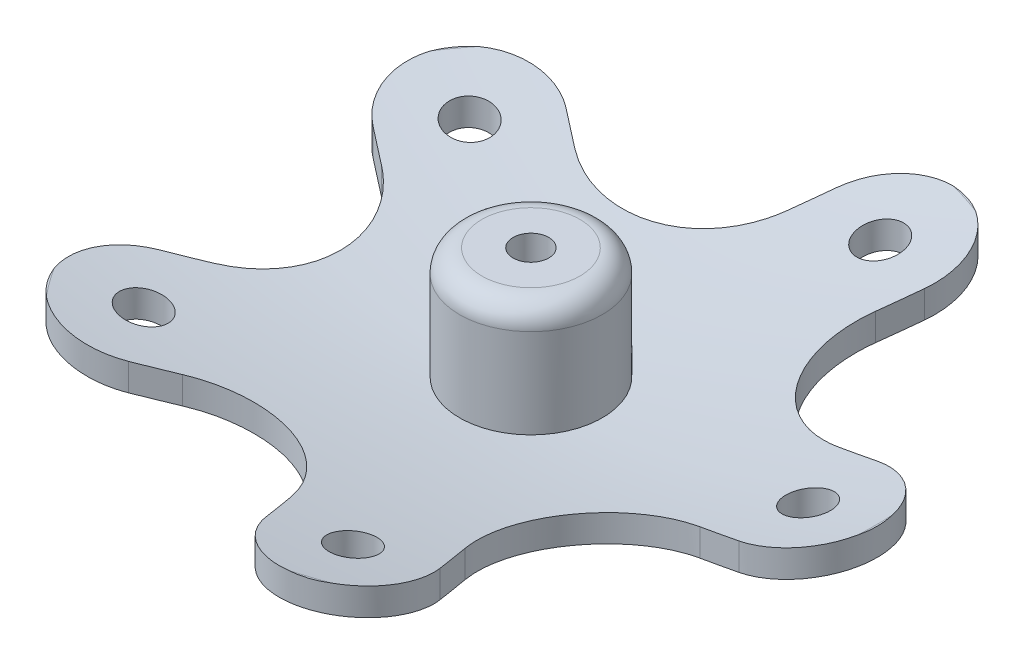
from build123d import *

# Parameters (mm, degrees)
SKETCH1_R                = 4.8
BOSS_EXTRUDE1_DEPTH      = 7.8
SKETCH2_R                = 1.2
CUT_EXTRUDE1_DEPTH       = 7.8
FILLET1_R                = 1.5
BOSS_EXTRUDE2_DEPTH      = 1.8
BOSS_EXTRUDE2_DEPTH_BACK = 4
SKETCH3_R                = 1.5
SKETCH5_R                = 0.75
CUT_EXTRUDE2_DEPTH       = 29.4


with BuildPart() as part:
    # Sketch1 → Boss-Extrude1 (new body)
    with BuildSketch(Plane(origin=(0, 0, 0), x_dir=(1, 0, 0), z_dir=(0, 1, 0))):
        with Locations(Location((0, 0, 0), (0, 0, 270))):
            Circle(SKETCH1_R)
    extrude(amount=BOSS_EXTRUDE1_DEPTH)

    # Sketch2 → Cut-Extrude1 (cut)
    with BuildSketch(Plane(origin=(0, 7.8, 0), x_dir=(1, 0, 0), z_dir=(0, 1, 0))):
        with Locations(Location((0, 0, 0), (0, 0, 270))):
            Circle(SKETCH2_R)
    extrude(amount=-CUT_EXTRUDE1_DEPTH, mode=Mode.SUBTRACT)

    # Fillet1
    fillet1_edges = [part.edges().sort_by_distance(p)[0] for p in [
        (0, 7.8, -4.8),
    ]]
    fillet(fillet1_edges, radius=FILLET1_R)

    # Sketch3 → Boss-Extrude2 (add, two sides: drawn at the far end of the back side and taken through both)
    with BuildSketch(Plane.XZ.offset(-BOSS_EXTRUDE2_DEPTH_BACK)):
        with BuildLine():
            Line((18.645, 4.65), (16.034849373, 4.65))
            ThreePointArc((16.034849373, 4.65), (10.371730413, 7.535503234), (9.377453759, 13.813118961))
            Line((9.377453759, 13.813118961), (10.184034661, 16.295519722))
            ThreePointArc((10.184034661, 16.295519722), (7.198550884, 22.154861547), (1.339209059, 19.16937777))
            Line((1.339209059, 19.16937777), (0.532628158, 16.686977008))
            ThreePointArc((0.532628158, 16.686977008), (-3.961648496, 12.192700355), (-10.239264222, 13.186977008))
            Line((-10.239264222, 13.186977008), (-12.350920437, 14.721185053))
            ThreePointArc((-12.350920437, 14.721185053), (-18.846050884, 13.692457452), (-17.817323283, 7.197327005))
            Line((-17.817323283, 7.197327005), (-15.705667069, 5.663118961))
            ThreePointArc((-15.705667069, 5.663118961), (-12.820163835, 0), (-15.705667069, -5.663118961))
            Line((-15.705667069, -5.663118961), (-17.817323283, -7.197327005))
            ThreePointArc((-17.817323283, -7.197327005), (-18.846050884, -13.692457452), (-12.350920437, -14.721185053))
            Line((-12.350920437, -14.721185053), (-10.239264222, -13.186977008))
            ThreePointArc((-10.239264222, -13.186977008), (-3.961648496, -12.192700355), (0.532628158, -16.686977008))
            Line((0.532628158, -16.686977008), (1.339209059, -19.16937777))
            ThreePointArc((1.339209059, -19.16937777), (7.198550884, -22.154861547), (10.184034661, -16.295519722))
            Line((10.184034661, -16.295519722), (9.377453759, -13.813118961))
            ThreePointArc((9.377453759, -13.813118961), (10.371730413, -7.535503234), (16.034849373, -4.65))
            Line((16.034849373, -4.65), (18.645, -4.65))
            ThreePointArc((18.645, -4.65), (23.295, 0), (18.645, 4.65))
        make_face()
        with Locations(Location((18.645, 0, 0), (0, 0, 270))):
            Circle(SKETCH3_R, mode=Mode.SUBTRACT)
        with Locations(Location((5.76162186, -17.732448746, 0), (0, 0, 270))):
            Circle(SKETCH3_R, mode=Mode.SUBTRACT)
        with Locations(Location((-15.08412186, -10.959256029, 0), (0, 0, 270))):
            Circle(SKETCH3_R, mode=Mode.SUBTRACT)
        with Locations(Location((-15.08412186, 10.959256029, 0), (0, 0, 270))):
            Circle(SKETCH3_R, mode=Mode.SUBTRACT)
        with Locations(Location((5.76162186, 17.732448746, 0), (0, 0, 270))):
            Circle(SKETCH3_R, mode=Mode.SUBTRACT)
    extrude(amount=BOSS_EXTRUDE2_DEPTH + BOSS_EXTRUDE2_DEPTH_BACK)

    # Sketch4 → Cut-Revolve1 (revolve, cut)
    with BuildSketch(Plane(origin=(0, 0, 0), x_dir=(0, 0, -1), z_dir=(1, 0, 0)), mode=Mode.PRIVATE) as cut_revolve1_sk:
        with BuildLine():
            Line((-4.8, 6.3), (-4.8, 0.289130899))
            add(Edge.make_bspline(
                [(-4.8, 0.289130899), (-5.128310529, 0.316213674), (-7.404332563, 0.51430271), (-11.621644173, 1.01166748), (-17.426006154, 1.977058563), (-21.269499314, 2.785790805), (-23.182029301, 3.226244481)],
                knots=[0.21922101, 0.21922101, 0.21922101, 0.21922101, 0.263650753, 0.527301506, 0.790952258, 1.054603011, 1.054603011, 1.054603011, 1.054603011], degree=3))
            Line((-23.182029301, 3.226244481), (-23.585993194, 3.226244481))
            Line((-23.585993194, 3.226244481), (-23.585993194, 1.47215977))
            add(Edge.make_bspline(
                [(0, -1.8), (-4.439858397, -1.638815811), (-11.950053748, -0.881676476), (-19.76672066, 0.606710231), (-23.185236489, 1.379865916), (-23.585993194, 1.47215977)],
                knots=[0, 0, 0, 0, 0.589330391, 1, 1.054603011, 1.054603011, 1.054603011, 1.054603011], degree=3))
            Line((0, -1.8), (0, -5.317605958))
            Line((0, -5.317605958), (-26.05969684, -5.317605958))
            Line((-26.05969684, -5.317605958), (-26.05969684, 6.3))
            Line((-26.05969684, 6.3), (-4.8, 6.3))
        make_face()
    revolve(cut_revolve1_sk.sketch.rotate(Axis((0, 0, 0), (0, 1, 0)), 180), axis=Axis((0, 0, 0), (0, 1, 0)), mode=Mode.SUBTRACT)

    # Sketch5 → Cut-Extrude2 (cut)
    with BuildSketch(Plane(origin=(0, 4, 0), x_dir=(1, 0, 0), z_dir=(0, 1, 0))):
        with Locations(Location((0, 0, 0), (0, 0, 270))):
            Circle(SKETCH5_R)
    extrude(amount=-CUT_EXTRUDE2_DEPTH, mode=Mode.SUBTRACT)


solid = part.part
